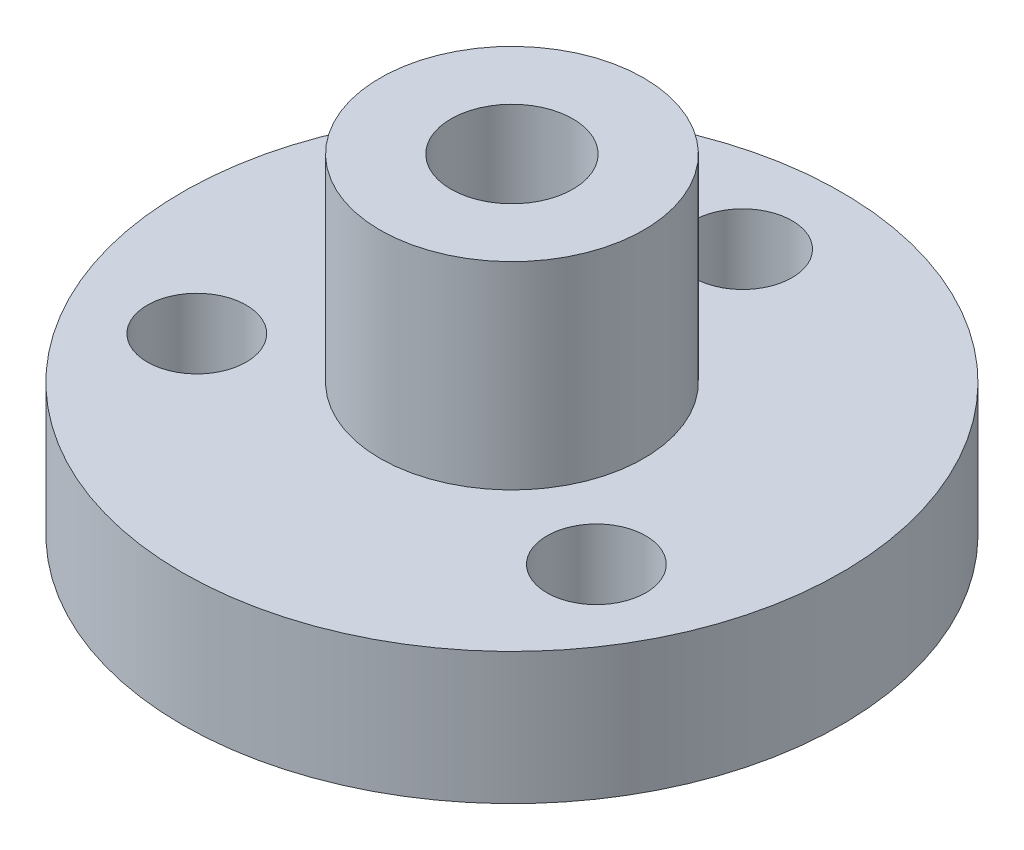
from build123d import *

# Parameters (mm, degrees)
SKETCH1_R           = 10
BOSS_EXTRUDE1_DEPTH = 4
SKETCH2_R           = 4
BOSS_EXTRUDE2_DEPTH = 6
SKETCH3_R           = 1.85
CUT_EXTRUDE1_DEPTH  = 18.320508076
SKETCH4_R           = 1.5
CUT_EXTRUDE2_DEPTH  = 16.362291496
CIRPATTERN1_COUNT   = 3


with BuildPart() as part:
    # Sketch1 → Boss-Extrude1 (new body)
    with BuildSketch(Plane(origin=(0, 0, 0), x_dir=(1, 0, 0), z_dir=(0, 1, 0))):
        with Locations(Location((0, 0, 0), (0, 0, 270))):
            Circle(SKETCH1_R)
    extrude(amount=BOSS_EXTRUDE1_DEPTH)

    # Sketch2 → Boss-Extrude2 (add)
    with BuildSketch(Plane(origin=(0, 4, 0), x_dir=(1, 0, 0), z_dir=(0, 1, 0))):
        with Locations(Location((0, 0, 0), (0, 0, 270))):
            Circle(SKETCH2_R)
    extrude(amount=BOSS_EXTRUDE2_DEPTH)

    # Sketch3 → Cut-Extrude1 (cut, through all)
    with BuildSketch(Plane(origin=(0, 10, 0), x_dir=(1, 0, 0), z_dir=(0, 1, 0))):
        with Locations(Location((0, 0, 0), (0, 0, 270))):
            Circle(SKETCH3_R)
    extrude(amount=-CUT_EXTRUDE1_DEPTH, mode=Mode.SUBTRACT)

    # Sketch4 → Cut-Extrude2 (cut, through all)
    with BuildSketch(Plane(origin=(0, 4, 0), x_dir=(1, 0, 0), z_dir=(0, 1, 0))):
        with Locations(Location((0, 7, 0), (0, 0, 270))):
            Circle(SKETCH4_R)
    cut_extrude2 = extrude(amount=-CUT_EXTRUDE2_DEPTH, mode=Mode.SUBTRACT)

    # CirPattern1: Cut-Extrude2 ×3 about axis
    cirpattern1_axis = Axis((0, 0, 0), (0, 1, 0))
    for i in range(1, CIRPATTERN1_COUNT):
        add(cut_extrude2.rotate(cirpattern1_axis, i * 360 / CIRPATTERN1_COUNT), mode=Mode.SUBTRACT)


solid = part.part
